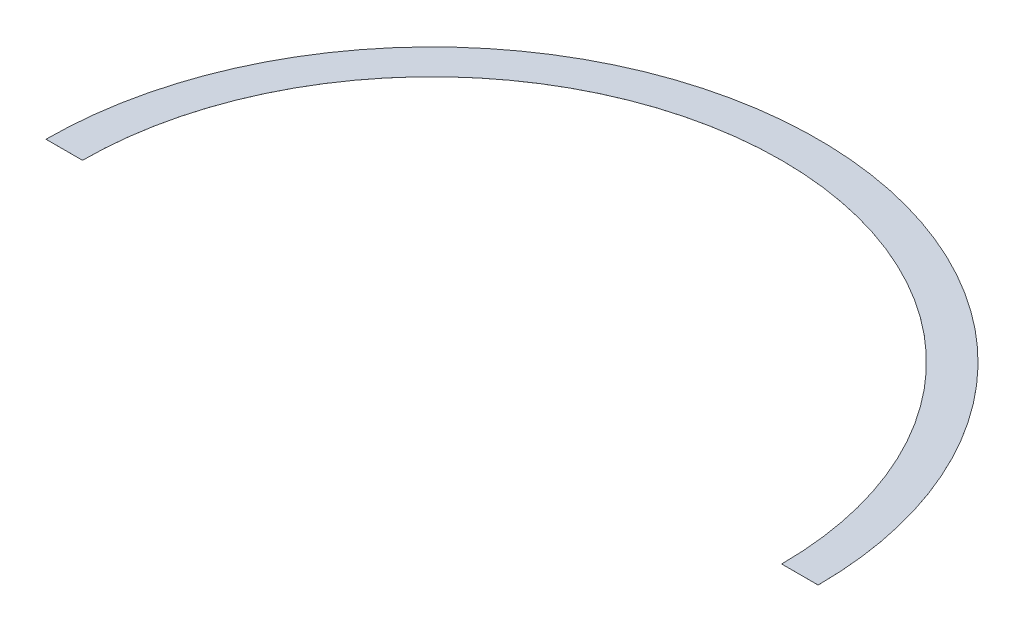
from build123d import *

# Parameters (mm, degrees)
RESSALTO_EXTRUS_O6_DEPTH = 0.01


with BuildPart() as part:
    # Esboço1 → Ressalto-extrusão6 (new body)
    with BuildSketch(Plane(origin=(0, 0, 0), x_dir=(1, 0, 0), z_dir=(0, 1, 0))):
        with BuildLine():
            Line((660.844658809, 1030.295840737), (679.779050052, 1030.295840737))
            ThreePointArc((679.779050052, 1030.295840737), (479.463444366, 1230.611446423), (279.147838681, 1030.295840737))
            Line((279.147838681, 1030.295840737), (298.082229915, 1030.295840737))
            ThreePointArc((298.082229915, 1030.295840737), (479.463444362, 1211.677055184), (660.844658809, 1030.295840737))
        make_face()
    extrude(amount=RESSALTO_EXTRUS_O6_DEPTH)


solid = part.part
